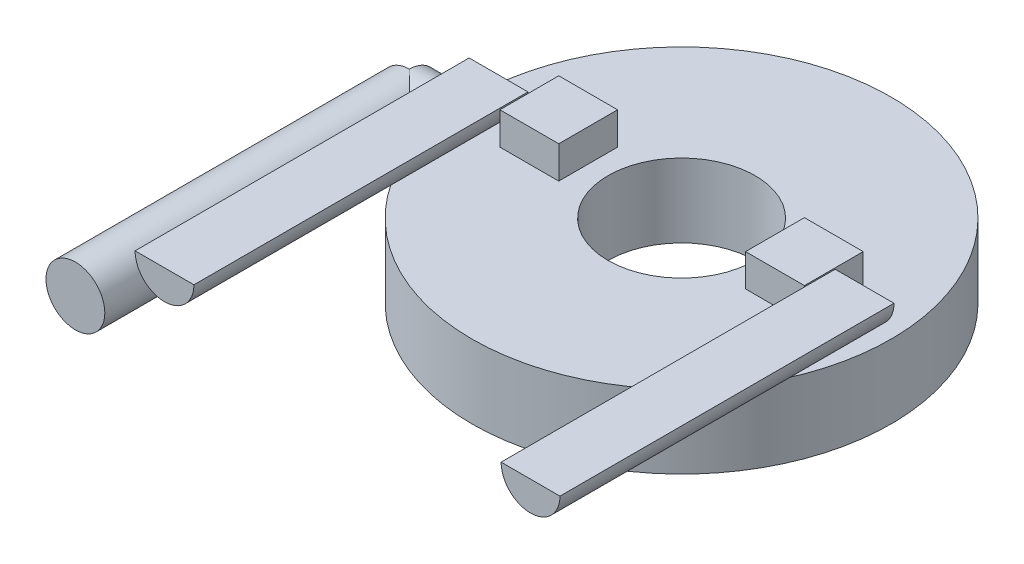
from build123d import *

# Parameters (mm, degrees)
SKETCH2_R            = 14.25
SKETCH2_R_2          = 5
BOSS_EXTRUDE1_DEPTH  = 5
SKETCH3_W            = 4
SKETCH3_H            = 4
BOSS_EXTRUDE2_DEPTH  = 2.2
SKETCH4_R            = 0.5
BOSS_EXTRUDE3_DEPTH  = 2
SKETCH6_R            = 0.5
BOSS_EXTRUDE4_DEPTH  = 2
SKETCH13_R           = 2
BOSS_EXTRUDE12_DEPTH = 50
SKETCH15_R           = 2
BOSS_EXTRUDE13_DEPTH = 4
SKETCH16_R           = 2
BOSS_EXTRUDE14_DEPTH = 60
SKETCH17_W           = 30.81160489
SKETCH17_H           = 4.482014718
CUT_EXTRUDE1_DEPTH   = 10.8
SKETCH18_W           = 93.143652273
SKETCH18_H           = 67.570442105
CUT_EXTRUDE2_DEPTH   = 43
SKETCH19_W           = 82.908946891
SKETCH19_H           = 58.215370207
CUT_EXTRUDE3_DEPTH   = 8


with BuildPart() as part:
    # Sketch2 → Boss-Extrude1 (new body)
    with BuildSketch(Plane(origin=(0, 0, 0), x_dir=(1, 0, 0), z_dir=(0, 1, 0))):
        with Locations(Location((0, 0, 0), (0, 0, 270))):
            Circle(SKETCH2_R)
        with Locations(Location((0, 0, 0), (0, 0, 270))):
            Circle(SKETCH2_R_2, mode=Mode.SUBTRACT)
    extrude(amount=BOSS_EXTRUDE1_DEPTH)

    # Sketch3 → Boss-Extrude2 (add)
    with BuildSketch(Plane(origin=(0, 5, 0), x_dir=(1, 0, 0), z_dir=(0, 1, 0))):
        with Locations((8.35, 0)):
            Rectangle(SKETCH3_W, SKETCH3_H)
        with Locations((-8.35, 0)):
            Rectangle(SKETCH3_W, SKETCH3_H)
    extrude(amount=BOSS_EXTRUDE2_DEPTH)

    # Sketch4 → Boss-Extrude3 (add)
    with BuildSketch(Plane(origin=(10.35, 0, 0), x_dir=(0, 0, -1), z_dir=(1, 0, 0))):
        with Locations((0, 5.475348584)):
            Circle(SKETCH4_R)
    extrude(amount=BOSS_EXTRUDE3_DEPTH)

    # Sketch6 → Boss-Extrude4 (add)
    with BuildSketch(Plane.ZY.offset(10.35)):
        with Locations((0, 5.435884372)):
            Circle(SKETCH6_R)
    extrude(amount=BOSS_EXTRUDE4_DEPTH)

    # Sketch13 → Boss-Extrude12 (add)
    with BuildSketch(Plane.XY):
        with Locations(Location((-12.441622338, 7.205589908, 0), (0, 0, 272.6257056))):
            Circle(SKETCH13_R)
        with Locations(Location((12.441622338, 7.205589908, 0), (0, 0, 180))):
            Circle(SKETCH13_R)
    extrude(amount=BOSS_EXTRUDE12_DEPTH)

    # Sketch17 → Cut-Extrude1 (cut)
    with BuildSketch(Plane(origin=(0, 0, 0), x_dir=(-1, 0, 0), z_dir=(0, 0, -1))):
        with Locations((-0.964180107, 9.446597267)):
            Rectangle(SKETCH17_W, SKETCH17_H)
    extrude(amount=-CUT_EXTRUDE1_DEPTH, mode=Mode.SUBTRACT)


with BuildPart() as body_2:
    # Sketch15 → Boss-Extrude13 (new body)
    with BuildSketch(Plane(origin=(-14.5, 0, 0), x_dir=(0, 0, -1), z_dir=(1, 0, 0))):
        with Locations((0, 2.517001549)):
            Circle(SKETCH15_R)
    extrude(amount=-BOSS_EXTRUDE13_DEPTH)

    # Sketch16 → Boss-Extrude14 (add)
    with BuildSketch(Plane(origin=(0, 11.710958491, 0), x_dir=(1, 0, 0), z_dir=(0, 0, 1))):
        with Locations(Location((-18.5, -9.193956942, 0), (0, 0, 90))):
            Circle(SKETCH16_R)
    extrude(amount=BOSS_EXTRUDE14_DEPTH)


with BuildPart() as cut_extrude2_tool:
    # Sketch18 → Cut-Extrude2 (new body)
    with BuildSketch(Plane.XY.offset(22.71)):
        with Locations((-3.408022591, 1.268285043)):
            Rectangle(SKETCH18_W, SKETCH18_H)
    extrude(amount=CUT_EXTRUDE2_DEPTH)


with BuildPart() as part_1:
    add(part.part)

    # Cut-Extrude2: cut by cut_extrude2_tool
    add(cut_extrude2_tool.part, mode=Mode.SUBTRACT)

    # Sketch19 → Cut-Extrude3 (cut)
    with BuildSketch(Plane(origin=(0, 7.205589908, 0), x_dir=(1, 0, 0), z_dir=(0, 1, 0))):
        with Locations((3.634474693, -11.396239252)):
            Rectangle(SKETCH19_W, SKETCH19_H)
    extrude(amount=CUT_EXTRUDE3_DEPTH, mode=Mode.SUBTRACT)


with BuildPart() as body_2_1:
    add(body_2.part)

    # Cut-Extrude2: cut by cut_extrude2_tool
    add(cut_extrude2_tool.part, mode=Mode.SUBTRACT)


solid = Compound([part_1.part, body_2_1.part])
